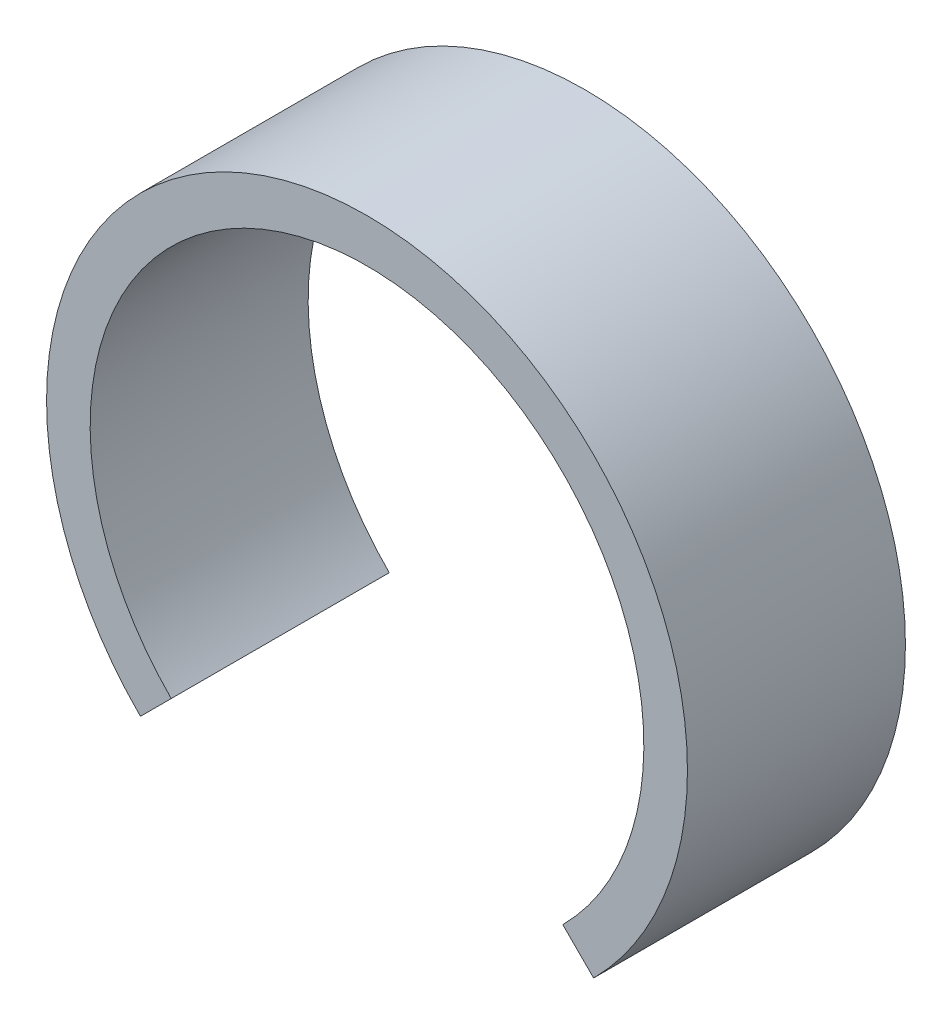
from build123d import *

# Parameters (mm, degrees)
EXTRUDE_1_DEPTH = 10


with BuildPart() as part:
    # 스케치1 → 보스-돌출1 (new body)
    with BuildSketch(Plane.XY):
        with BuildLine():
            Line((-10.394469683, -10.394469683), (-8.980256121, -8.980256121))
            ThreePointArc((-8.980256121, -8.980256121), (-4.860079591, 11.733270063), (12.7, 0))
            ThreePointArc((12.7, 0), (11.733270063, -4.860079591), (8.980256121, -8.980256121))
            Line((8.980256121, -8.980256121), (10.394469683, -10.394469683))
            ThreePointArc((10.394469683, -10.394469683), (13.581029128, -5.625446456), (14.7, 0))
            ThreePointArc((14.7, 0), (-5.625446456, 13.581029128), (-10.394469683, -10.394469683))
        make_face()
    extrude(amount=EXTRUDE_1_DEPTH)


solid = part.part
